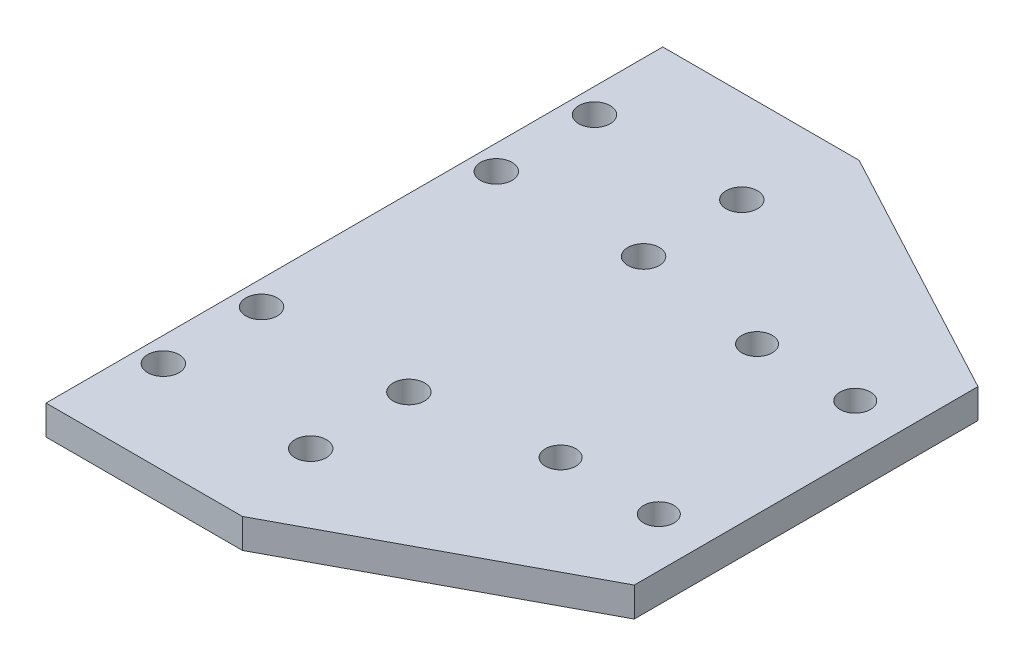
from build123d import *

# Parameters (mm, degrees)
SKETCH_1_R      = 1.6
SKETCH_1_R_2    = 1.55
EXTRUDE_1_DEPTH = 3


with BuildPart() as part:
    # 草图1 → 凸台-拉伸1 (new body)
    with BuildSketch(Plane(origin=(0, 0, 0), x_dir=(1, 0, 0), z_dir=(0, 1, 0))):
        Polygon((-50, -31.4), (-50, 31.4), (-30, 31.4), (-4, 17.5), (-4, -17.5), (-30, -31.4), align=None)
        with Locations(Location((-47.5, 21.95, 0), (0, 0, 270))):
            Circle(SKETCH_1_R, mode=Mode.SUBTRACT)
        with Locations(Location((-32.5, 21.95, 0), (0, 0, 270))):
            Circle(SKETCH_1_R, mode=Mode.SUBTRACT)
        with Locations(Location((-47.5, 11.95, 0), (0, 0, 270))):
            Circle(SKETCH_1_R, mode=Mode.SUBTRACT)
        with Locations(Location((-32.5, 11.95, 0), (0, 0, 270))):
            Circle(SKETCH_1_R, mode=Mode.SUBTRACT)
        with Locations(Location((-32.5, -11.95, 0), (0, 0, 270))):
            Circle(SKETCH_1_R, mode=Mode.SUBTRACT)
        with Locations(Location((-47.5, -11.95, 0), (0, 0, 270))):
            Circle(SKETCH_1_R, mode=Mode.SUBTRACT)
        with Locations(Location((-32.5, -21.95, 0), (0, 0, 270))):
            Circle(SKETCH_1_R, mode=Mode.SUBTRACT)
        with Locations(Location((-47.5, -21.95, 0), (0, 0, 270))):
            Circle(SKETCH_1_R, mode=Mode.SUBTRACT)
        with Locations(Location((-19, 10, 0), (0, 0, 270))):
            Circle(SKETCH_1_R_2, mode=Mode.SUBTRACT)
        with Locations(Location((-9, 10, 0), (0, 0, 270))):
            Circle(SKETCH_1_R_2, mode=Mode.SUBTRACT)
        with Locations(Location((-9, -10, 0), (0, 0, 270))):
            Circle(SKETCH_1_R_2, mode=Mode.SUBTRACT)
        with Locations(Location((-19, -10, 0), (0, 0, 270))):
            Circle(SKETCH_1_R_2, mode=Mode.SUBTRACT)
    extrude(amount=EXTRUDE_1_DEPTH)


solid = part.part
